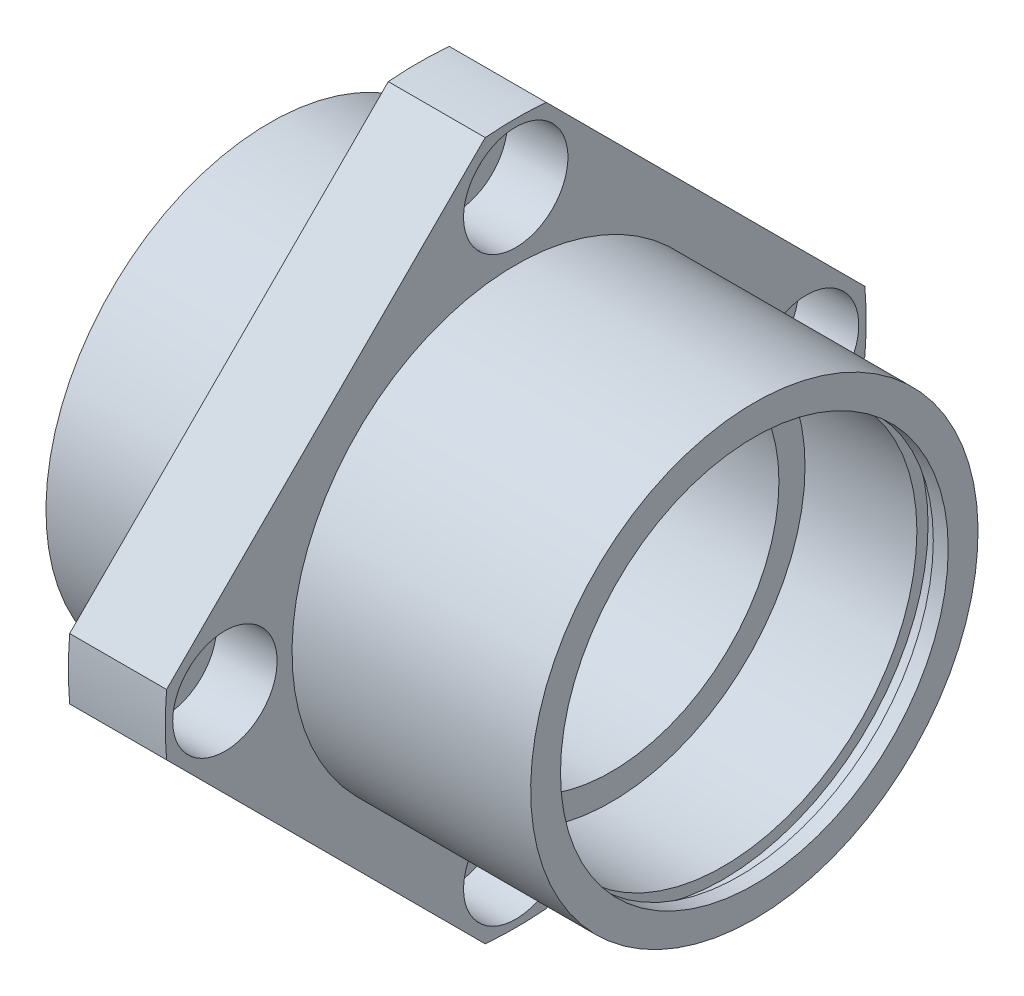
from build123d import *

# Parameters (mm, degrees)
SKETCH7_R          = 72
CUT_EXTRUDE1_DEPTH = 13


with BuildPart() as part:
    # Sketch1 → Revolve1 (revolve)
    with BuildSketch(Plane.XY, mode=Mode.PRIVATE) as revolve1_sk:
        Polygon((-65, 0), (-65, 30), (-45, 30), (-45, 47), (-32, 47), (-32, 30), (0, 30), (0, 0), align=None)
    revolve(revolve1_sk.sketch.rotate(Axis((0, 0, 0), (-1, 0, 0)), 180), axis=Axis((0, 0, 0), (-1, 0, 0)))

    # Sketch2 → Cut-Revolve1 (revolve, cut)
    with BuildSketch(Plane.XY, mode=Mode.PRIVATE) as cut_revolve1_sk:
        Polygon((-65, 0), (-65, 26), (-63, 26), (-63, 27.5), (-60.8, 27.5), (-60.8, 26), (-45.8, 26), (-45.8, 22.5), (-19.2, 22.5), (-19.2, 26), (-4.2, 26), (-4.2, 27.5), (-2, 27.5), (-2, 26), (0, 26), (0, 0), align=None)
    revolve(cut_revolve1_sk.sketch.rotate(Axis((0, 0, 0), (-1, 0, 0)), 270), axis=Axis((0, 0, 0), (-1, 0, 0)), mode=Mode.SUBTRACT)

    # Sketch3 → Cut-Revolve2 (revolve, cut)
    with BuildSketch(Plane.XY, mode=Mode.PRIVATE) as cut_revolve2_sk:
        Polygon((-45, 39), (-45, 43.5), (-40.1, 43.5), (-40.1, 46), (-32, 46), (-32, 39), align=None)
    revolve(cut_revolve2_sk.sketch.rotate(Axis((-32, 39, 0), (-1, 0, 0)), 270), axis=Axis((-32, 39, 0), (-1, 0, 0)), mode=Mode.SUBTRACT)

    # Sketch4 → Cut-Revolve3 (revolve, cut)
    with BuildSketch(Plane.XY.offset(39), mode=Mode.PRIVATE) as cut_revolve3_sk:
        Polygon((-45, 0), (-45, 4.5), (-40.1, 4.5), (-40.1, 7), (-32, 7), (-32, 0), align=None)
    revolve(cut_revolve3_sk.sketch.rotate(Axis((-32, 0, 39), (-1, 0, 0)), 270), axis=Axis((-32, 0, 39), (-1, 0, 0)), mode=Mode.SUBTRACT)

    # Sketch5 → Cut-Revolve4 (revolve, cut)
    with BuildSketch(Plane.XY, mode=Mode.PRIVATE) as cut_revolve4_sk:
        Polygon((-45, -39), (-45, -34.5), (-40.1, -34.5), (-40.1, -32), (-32, -32), (-32, -39), align=None)
    revolve(cut_revolve4_sk.sketch.rotate(Axis((-32, -39, 0), (-1, 0, 0)), 270), axis=Axis((-32, -39, 0), (-1, 0, 0)), mode=Mode.SUBTRACT)

    # Sketch6 → Cut-Revolve5 (revolve, cut)
    with BuildSketch(Plane.XY.offset(-39), mode=Mode.PRIVATE) as cut_revolve5_sk:
        Polygon((-45, 0), (-45, 4.5), (-40.1, 4.5), (-40.1, 7), (-32, 7), (-32, 0), align=None)
    revolve(cut_revolve5_sk.sketch.rotate(Axis((-32, 0, -39), (-1, 0, 0)), 270), axis=Axis((-32, 0, -39), (-1, 0, 0)), mode=Mode.SUBTRACT)

    # Sketch7 → Cut-Extrude1 (cut)
    with BuildSketch(Plane(origin=(-32, 0, 0), x_dir=(0, 0, -1), z_dir=(1, 0, 0))):
        Circle(SKETCH7_R)
        Polygon((-50.911688245, 0), (0, -50.911688245), (50.911688245, 0), (0, 50.911688245), align=None, mode=Mode.SUBTRACT)
    extrude(amount=-CUT_EXTRUDE1_DEPTH, mode=Mode.SUBTRACT)


solid = part.part
